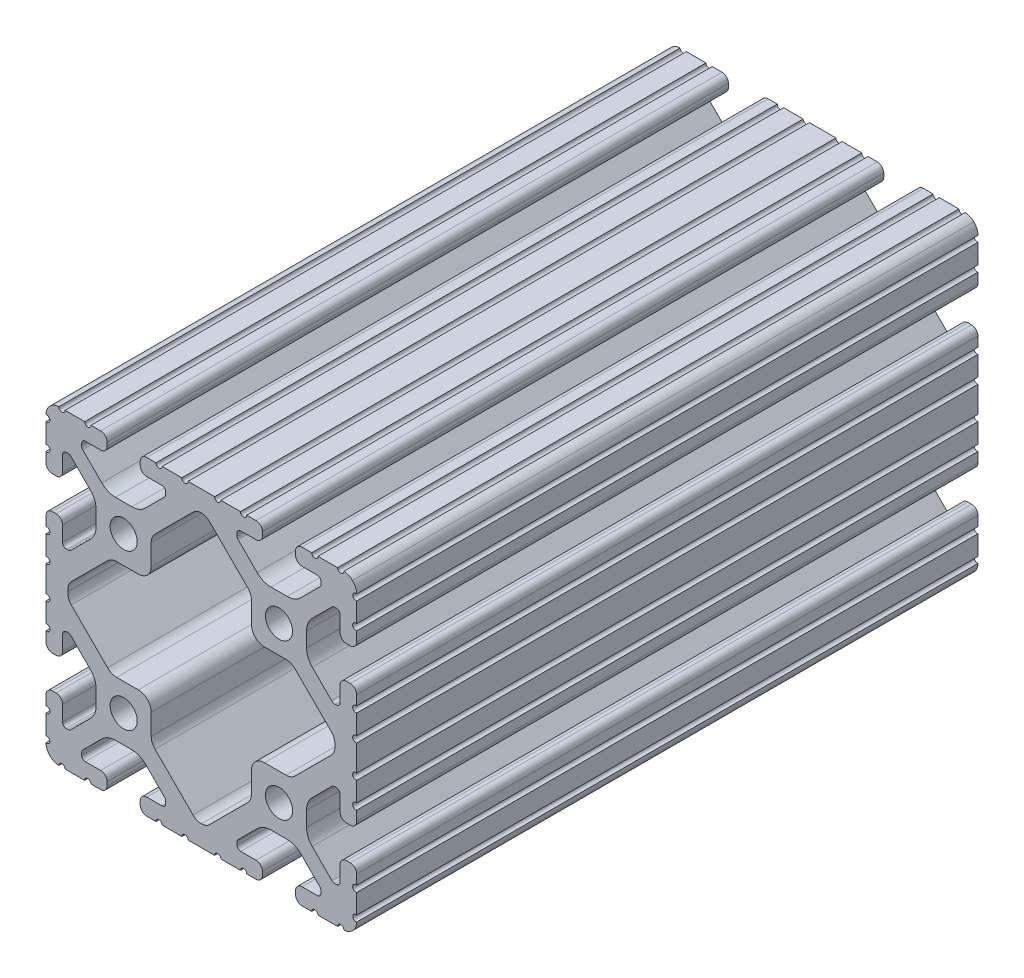
from build123d import *

# Parameters (mm, degrees)
SKETCH1_R           = 3.3274
BOSS_EXTRUDE1_DEPTH = 76.2


with BuildPart() as part:
    # Sketch1 → Boss-Extrude1 (new, symmetric)
    with BuildSketch(Plane.XY):
        with BuildLine():
            Line((-4.777313069, 38.1), (-9.605274992, 38.1))
            ThreePointArc((-9.605274992, 38.1), (-10.367071033, 37.320370693), (-11.128867074, 38.1))
            Line((-11.128867074, 38.1), (-13.4112, 38.1))
            ThreePointArc((-13.4112, 38.1), (-14.524751759, 37.638751759), (-14.986, 36.5252))
            Line((-14.986, 36.5252), (-14.986, 35.6108))
            ThreePointArc((-14.986, 35.6108), (-14.524751759, 34.497248241), (-13.4112, 34.036))
            Line((-13.4112, 34.036), (-9.652, 34.036))
            ThreePointArc((-9.652, 34.036), (-9.023382072, 33.775617928), (-8.763, 33.147))
            Line((-8.763, 33.147), (-8.763, 32.493548179))
            ThreePointArc((-8.763, 32.493548179), (-8.830670886, 32.153343113), (-9.023381298, 31.864931024))
            Line((-9.023381298, 31.864931024), (-13.690712501, 27.197588341))
            ThreePointArc((-13.690712501, 27.197588341), (-15.231659955, 26.167958114), (-17.049332421, 25.8064))
            Line((-17.049332421, 25.8064), (-21.050667579, 25.8064))
            ThreePointArc((-21.050667579, 25.8064), (-22.868340045, 26.167958114), (-24.409287499, 27.197588341))
            Line((-24.409287499, 27.197588341), (-29.100231244, 31.888543625))
            ThreePointArc((-29.100231244, 31.888543625), (-29.326675076, 32.273872751), (-29.337, 32.720693454))
            Line((-29.337, 32.720693454), (-29.337, 33.147))
            ThreePointArc((-29.337, 33.147), (-29.076617928, 33.775617928), (-28.448, 34.036))
            Line((-28.448, 34.036), (-24.6888, 34.036))
            ThreePointArc((-24.6888, 34.036), (-23.575248241, 34.497248241), (-23.114, 35.6108))
            Line((-23.114, 35.6108), (-23.114, 36.5252))
            ThreePointArc((-23.114, 36.5252), (-23.575248241, 37.638751759), (-24.6888, 38.1))
            Line((-24.6888, 38.1), (-27.077211227, 38.1))
            ThreePointArc((-27.077211227, 38.1), (-27.839158581, 37.32021942), (-28.601105935, 38.1))
            Line((-28.601105935, 38.1), (-33.428778994, 38.1))
            ThreePointArc((-33.428778994, 38.1), (-34.190730434, 37.320215335), (-34.952681874, 38.1))
            ThreePointArc((-34.952681874, 38.1), (-36.106286572, 37.843374398), (-37.086123144, 37.182631793))
            ThreePointArc((-37.086123144, 37.182631793), (-37.837757813, 36.120195002), (-38.1, 34.845457521))
            ThreePointArc((-38.1, 34.845457521), (-37.141472621, 34.109236774), (-38.1, 33.373016026))
            Line((-38.1, 33.373016026), (-38.1, 28.545258062))
            ThreePointArc((-38.1, 28.545258062), (-37.117780706, 27.7845421), (-38.1, 27.023826138))
            Line((-38.1, 27.023826138), (-38.1, 24.630195866))
            ThreePointArc((-38.1, 24.630195866), (-37.638751813, 23.516644236), (-36.525200183, 23.055396049))
            Line((-36.525200183, 23.055396049), (-35.6108, 23.055396049))
            ThreePointArc((-35.6108, 23.055396049), (-34.497248241, 23.51664429), (-34.036, 24.630196049))
            Line((-34.036, 24.630196049), (-34.036, 28.448))
            ThreePointArc((-34.036, 28.448), (-33.775617928, 29.076617928), (-33.147, 29.337))
            Line((-33.147, 29.337), (-32.664287242, 29.337))
            ThreePointArc((-32.664287242, 29.337), (-32.324081166, 29.269328695), (-32.03566854, 29.076617155))
            Line((-32.03566854, 29.076617155), (-27.19758008, 24.238516795))
            ThreePointArc((-27.19758008, 24.238516795), (-26.167955879, 22.697572205), (-25.8064, 20.879905136))
            Line((-25.8064, 20.879905136), (-25.8064, 17.220094864))
            ThreePointArc((-25.8064, 17.220094864), (-26.167955879, 15.402427795), (-27.19758008, 13.861483205))
            Line((-27.19758008, 13.861483205), (-31.948944541, 9.110107057))
            ThreePointArc((-31.948944541, 9.110107057), (-32.333417096, 8.853210196), (-32.786933649, 8.763))
            Line((-32.786933649, 8.763), (-33.060275787, 8.763))
            ThreePointArc((-33.060275787, 8.763), (-33.750216995, 9.048783005), (-34.036, 9.738724213))
            Line((-34.036, 9.738724213), (-34.036, 13.469803585))
            ThreePointArc((-34.036, 13.469803585), (-34.497248348, 14.583355603), (-35.610800366, 15.044603951))
            Line((-35.610800366, 15.044603951), (-36.5252, 15.044603951))
            ThreePointArc((-36.5252, 15.044603951), (-37.638751759, 14.58335571), (-38.1, 13.469803951))
            Line((-38.1, 13.469803951), (-38.1, 11.075039289))
            ThreePointArc((-38.1, 11.075039289), (-37.117000248, 10.313517272), (-38.1, 9.551995255))
            Line((-38.1, 9.551995255), (-38.1, 4.723759308))
            ThreePointArc((-38.1, 4.723759308), (-37.117000248, 3.962237292), (-38.1, 3.200715275))
            Line((-38.1, 3.200715275), (-38.1, -3.200715275))
            ThreePointArc((-38.1, -3.200715275), (-37.117000248, -3.962237292), (-38.1, -4.723759308))
            Line((-38.1, -4.723759308), (-38.1, -9.551995255))
            ThreePointArc((-38.1, -9.551995255), (-37.117000248, -10.313517272), (-38.1, -11.075039289))
            Line((-38.1, -11.075039289), (-38.1, -13.469803951))
            ThreePointArc((-38.1, -13.469803951), (-37.638751759, -14.58335571), (-36.5252, -15.044603951))
            Line((-36.5252, -15.044603951), (-35.610800366, -15.044603951))
            ThreePointArc((-35.610800366, -15.044603951), (-34.497248348, -14.583355603), (-34.036, -13.469803585))
            Line((-34.036, -13.469803585), (-34.036, -9.738724213))
            ThreePointArc((-34.036, -9.738724213), (-33.750216995, -9.048783005), (-33.060275787, -8.763))
            Line((-33.060275787, -8.763), (-32.786933649, -8.763))
            ThreePointArc((-32.786933649, -8.763), (-32.333417096, -8.853210196), (-31.948944541, -9.110107057))
            Line((-31.948944541, -9.110107057), (-27.19758008, -13.861483205))
            ThreePointArc((-27.19758008, -13.861483205), (-26.167955879, -15.402427795), (-25.8064, -17.220094864))
            Line((-25.8064, -17.220094864), (-25.8064, -20.879905136))
            ThreePointArc((-25.8064, -20.879905136), (-26.167955879, -22.697572205), (-27.19758008, -24.238516795))
            Line((-27.19758008, -24.238516795), (-32.03566854, -29.076617155))
            ThreePointArc((-32.03566854, -29.076617155), (-32.324081166, -29.269328695), (-32.664287242, -29.337))
            Line((-32.664287242, -29.337), (-33.147, -29.337))
            ThreePointArc((-33.147, -29.337), (-33.775617928, -29.076617928), (-34.036, -28.448))
            Line((-34.036, -28.448), (-34.036, -24.630196049))
            ThreePointArc((-34.036, -24.630196049), (-34.497248241, -23.51664429), (-35.6108, -23.055396049))
            Line((-35.6108, -23.055396049), (-36.525200183, -23.055396049))
            ThreePointArc((-36.525200183, -23.055396049), (-37.638751813, -23.516644236), (-38.1, -24.630195866))
            Line((-38.1, -24.630195866), (-38.1, -27.023826138))
            ThreePointArc((-38.1, -27.023826138), (-37.117780706, -27.7845421), (-38.1, -28.545258062))
            Line((-38.1, -28.545258062), (-38.1, -33.373016026))
            ThreePointArc((-38.1, -33.373016026), (-37.141472621, -34.109236774), (-38.1, -34.845457521))
            ThreePointArc((-38.1, -34.845457521), (-37.837757813, -36.120195002), (-37.086123144, -37.182631793))
            ThreePointArc((-37.086123144, -37.182631793), (-36.106286572, -37.843374398), (-34.952681874, -38.1))
            ThreePointArc((-34.952681874, -38.1), (-34.190730434, -37.320215335), (-33.428778994, -38.1))
            Line((-33.428778994, -38.1), (-28.601105935, -38.1))
            ThreePointArc((-28.601105935, -38.1), (-27.839158581, -37.32021942), (-27.077211227, -38.1))
            Line((-27.077211227, -38.1), (-24.6888, -38.1))
            ThreePointArc((-24.6888, -38.1), (-23.575248241, -37.638751759), (-23.114, -36.5252))
            Line((-23.114, -36.5252), (-23.114, -35.6108))
            ThreePointArc((-23.114, -35.6108), (-23.575248241, -34.497248241), (-24.6888, -34.036))
            Line((-24.6888, -34.036), (-28.448, -34.036))
            ThreePointArc((-28.448, -34.036), (-29.076617928, -33.775617928), (-29.337, -33.147))
            Line((-29.337, -33.147), (-29.337, -32.720693454))
            ThreePointArc((-29.337, -32.720693454), (-29.326675076, -32.273872751), (-29.100231244, -31.888543625))
            Line((-29.100231244, -31.888543625), (-24.409287499, -27.197588341))
            ThreePointArc((-24.409287499, -27.197588341), (-22.868340045, -26.167958114), (-21.050667579, -25.8064))
            Line((-21.050667579, -25.8064), (-17.049332421, -25.8064))
            ThreePointArc((-17.049332421, -25.8064), (-15.231659955, -26.167958114), (-13.690712501, -27.197588341))
            Line((-13.690712501, -27.197588341), (-9.023381298, -31.864931024))
            ThreePointArc((-9.023381298, -31.864931024), (-8.830670886, -32.153343113), (-8.763, -32.493548179))
            Line((-8.763, -32.493548179), (-8.763, -33.147))
            ThreePointArc((-8.763, -33.147), (-9.023382072, -33.775617928), (-9.652, -34.036))
            Line((-9.652, -34.036), (-13.4112, -34.036))
            ThreePointArc((-13.4112, -34.036), (-14.524751759, -34.497248241), (-14.986, -35.6108))
            Line((-14.986, -35.6108), (-14.986, -36.5252))
            ThreePointArc((-14.986, -36.5252), (-14.524751759, -37.638751759), (-13.4112, -38.1))
            Line((-13.4112, -38.1), (-11.128867074, -38.1))
            ThreePointArc((-11.128867074, -38.1), (-10.367071033, -37.320370693), (-9.605274992, -38.1))
            Line((-9.605274992, -38.1), (-4.777313069, -38.1))
            ThreePointArc((-4.777313069, -38.1), (-4.015517029, -37.320370693), (-3.253720988, -38.1))
            Line((-3.253720988, -38.1), (3.253720988, -38.1))
            ThreePointArc((3.253720988, -38.1), (4.015517029, -37.320370693), (4.777313069, -38.1))
            Line((4.777313069, -38.1), (9.605274992, -38.1))
            ThreePointArc((9.605274992, -38.1), (10.367071033, -37.320370693), (11.128867074, -38.1))
            Line((11.128867074, -38.1), (13.4112, -38.1))
            ThreePointArc((13.4112, -38.1), (14.524751759, -37.638751759), (14.986, -36.5252))
            Line((14.986, -36.5252), (14.986, -35.6108))
            ThreePointArc((14.986, -35.6108), (14.524751759, -34.497248241), (13.4112, -34.036))
            Line((13.4112, -34.036), (9.652, -34.036))
            ThreePointArc((9.652, -34.036), (9.023382072, -33.775617928), (8.763, -33.147))
            Line((8.763, -33.147), (8.763, -32.493548179))
            ThreePointArc((8.763, -32.493548179), (8.830670886, -32.153343113), (9.023381298, -31.864931024))
            Line((9.023381298, -31.864931024), (13.690712501, -27.197588341))
            ThreePointArc((13.690712501, -27.197588341), (15.231659955, -26.167958114), (17.049332421, -25.8064))
            Line((17.049332421, -25.8064), (21.050667579, -25.8064))
            ThreePointArc((21.050667579, -25.8064), (22.868340045, -26.167958114), (24.409287499, -27.197588341))
            Line((24.409287499, -27.197588341), (29.100231244, -31.888543625))
            ThreePointArc((29.100231244, -31.888543625), (29.326675076, -32.273872751), (29.337, -32.720693454))
            Line((29.337, -32.720693454), (29.337, -33.147))
            ThreePointArc((29.337, -33.147), (29.076617928, -33.775617928), (28.448, -34.036))
            Line((28.448, -34.036), (24.6888, -34.036))
            ThreePointArc((24.6888, -34.036), (23.575248241, -34.497248241), (23.114, -35.6108))
            Line((23.114, -35.6108), (23.114, -36.5252))
            ThreePointArc((23.114, -36.5252), (23.575248241, -37.638751759), (24.6888, -38.1))
            Line((24.6888, -38.1), (27.077211227, -38.1))
            ThreePointArc((27.077211227, -38.1), (27.839158581, -37.32021942), (28.601105935, -38.1))
            Line((28.601105935, -38.1), (33.428778994, -38.1))
            ThreePointArc((33.428778994, -38.1), (34.190730434, -37.320215335), (34.952681874, -38.1))
            ThreePointArc((34.952681874, -38.1), (36.106286572, -37.843374398), (37.086123144, -37.182631793))
            ThreePointArc((37.086123144, -37.182631793), (37.837757813, -36.120195002), (38.1, -34.845457521))
            ThreePointArc((38.1, -34.845457521), (37.141472621, -34.109236774), (38.1, -33.373016026))
            Line((38.1, -33.373016026), (38.1, -28.545258062))
            ThreePointArc((38.1, -28.545258062), (37.117780706, -27.7845421), (38.1, -27.023826138))
            Line((38.1, -27.023826138), (38.1, -24.630195866))
            ThreePointArc((38.1, -24.630195866), (37.638751813, -23.516644236), (36.525200183, -23.055396049))
            Line((36.525200183, -23.055396049), (35.6108, -23.055396049))
            ThreePointArc((35.6108, -23.055396049), (34.497248241, -23.51664429), (34.036, -24.630196049))
            Line((34.036, -24.630196049), (34.036, -28.448))
            ThreePointArc((34.036, -28.448), (33.775617928, -29.076617928), (33.147, -29.337))
            Line((33.147, -29.337), (32.664287242, -29.337))
            ThreePointArc((32.664287242, -29.337), (32.324081166, -29.269328695), (32.03566854, -29.076617155))
            Line((32.03566854, -29.076617155), (27.19758008, -24.238516795))
            ThreePointArc((27.19758008, -24.238516795), (26.167955879, -22.697572205), (25.8064, -20.879905136))
            Line((25.8064, -20.879905136), (25.8064, -17.220094864))
            ThreePointArc((25.8064, -17.220094864), (26.167955879, -15.402427795), (27.19758008, -13.861483205))
            Line((27.19758008, -13.861483205), (31.948944541, -9.110107057))
            ThreePointArc((31.948944541, -9.110107057), (32.333417096, -8.853210196), (32.786933649, -8.763))
            Line((32.786933649, -8.763), (33.060275787, -8.763))
            ThreePointArc((33.060275787, -8.763), (33.750216995, -9.048783005), (34.036, -9.738724213))
            Line((34.036, -9.738724213), (34.036, -13.469803585))
            ThreePointArc((34.036, -13.469803585), (34.497248348, -14.583355603), (35.610800366, -15.044603951))
            Line((35.610800366, -15.044603951), (36.5252, -15.044603951))
            ThreePointArc((36.5252, -15.044603951), (37.638751759, -14.58335571), (38.1, -13.469803951))
            Line((38.1, -13.469803951), (38.1, -11.075039289))
            ThreePointArc((38.1, -11.075039289), (37.117000248, -10.313517272), (38.1, -9.551995255))
            Line((38.1, -9.551995255), (38.1, -4.723759308))
            ThreePointArc((38.1, -4.723759308), (37.117000248, -3.962237292), (38.1, -3.200715275))
            Line((38.1, -3.200715275), (38.1, 3.200715275))
            ThreePointArc((38.1, 3.200715275), (37.117000248, 3.962237292), (38.1, 4.723759308))
            Line((38.1, 4.723759308), (38.1, 9.551995255))
            ThreePointArc((38.1, 9.551995255), (37.117000248, 10.313517272), (38.1, 11.075039289))
            Line((38.1, 11.075039289), (38.1, 13.469803951))
            ThreePointArc((38.1, 13.469803951), (37.638751759, 14.58335571), (36.5252, 15.044603951))
            Line((36.5252, 15.044603951), (35.610800366, 15.044603951))
            ThreePointArc((35.610800366, 15.044603951), (34.497248348, 14.583355603), (34.036, 13.469803585))
            Line((34.036, 13.469803585), (34.036, 9.738724213))
            ThreePointArc((34.036, 9.738724213), (33.750216995, 9.048783005), (33.060275787, 8.763))
            Line((33.060275787, 8.763), (32.786933649, 8.763))
            ThreePointArc((32.786933649, 8.763), (32.333417096, 8.853210196), (31.948944541, 9.110107057))
            Line((31.948944541, 9.110107057), (27.19758008, 13.861483205))
            ThreePointArc((27.19758008, 13.861483205), (26.167955879, 15.402427795), (25.8064, 17.220094864))
            Line((25.8064, 17.220094864), (25.8064, 20.879905136))
            ThreePointArc((25.8064, 20.879905136), (26.167955879, 22.697572205), (27.19758008, 24.238516795))
            Line((27.19758008, 24.238516795), (32.03566854, 29.076617155))
            ThreePointArc((32.03566854, 29.076617155), (32.324081166, 29.269328695), (32.664287242, 29.337))
            Line((32.664287242, 29.337), (33.147, 29.337))
            ThreePointArc((33.147, 29.337), (33.775617928, 29.076617928), (34.036, 28.448))
            Line((34.036, 28.448), (34.036, 24.630196049))
            ThreePointArc((34.036, 24.630196049), (34.497248241, 23.51664429), (35.6108, 23.055396049))
            Line((35.6108, 23.055396049), (36.525200183, 23.055396049))
            ThreePointArc((36.525200183, 23.055396049), (37.638751813, 23.516644236), (38.1, 24.630195866))
            Line((38.1, 24.630195866), (38.1, 27.023826138))
            ThreePointArc((38.1, 27.023826138), (37.117780706, 27.7845421), (38.1, 28.545258062))
            Line((38.1, 28.545258062), (38.1, 33.373016026))
            ThreePointArc((38.1, 33.373016026), (37.141472621, 34.109236774), (38.1, 34.845457521))
            ThreePointArc((38.1, 34.845457521), (37.837757813, 36.120195002), (37.086123144, 37.182631793))
            ThreePointArc((37.086123144, 37.182631793), (36.106286572, 37.843374398), (34.952681874, 38.1))
            ThreePointArc((34.952681874, 38.1), (34.190730434, 37.320215335), (33.428778994, 38.1))
            Line((33.428778994, 38.1), (28.601105935, 38.1))
            ThreePointArc((28.601105935, 38.1), (27.839158581, 37.32021942), (27.077211227, 38.1))
            Line((27.077211227, 38.1), (24.6888, 38.1))
            ThreePointArc((24.6888, 38.1), (23.575248241, 37.638751759), (23.114, 36.5252))
            Line((23.114, 36.5252), (23.114, 35.6108))
            ThreePointArc((23.114, 35.6108), (23.575248241, 34.497248241), (24.6888, 34.036))
            Line((24.6888, 34.036), (28.448, 34.036))
            ThreePointArc((28.448, 34.036), (29.076617928, 33.775617928), (29.337, 33.147))
            Line((29.337, 33.147), (29.337, 32.720693454))
            ThreePointArc((29.337, 32.720693454), (29.326675076, 32.273872751), (29.100231244, 31.888543625))
            Line((29.100231244, 31.888543625), (24.409287499, 27.197588341))
            ThreePointArc((24.409287499, 27.197588341), (22.868340045, 26.167958114), (21.050667579, 25.8064))
            Line((21.050667579, 25.8064), (17.049332421, 25.8064))
            ThreePointArc((17.049332421, 25.8064), (15.231659955, 26.167958114), (13.690712501, 27.197588341))
            Line((13.690712501, 27.197588341), (9.023381298, 31.864931024))
            ThreePointArc((9.023381298, 31.864931024), (8.830670886, 32.153343113), (8.763, 32.493548179))
            Line((8.763, 32.493548179), (8.763, 33.147))
            ThreePointArc((8.763, 33.147), (9.023382072, 33.775617928), (9.652, 34.036))
            Line((9.652, 34.036), (13.4112, 34.036))
            ThreePointArc((13.4112, 34.036), (14.524751759, 34.497248241), (14.986, 35.6108))
            Line((14.986, 35.6108), (14.986, 36.5252))
            ThreePointArc((14.986, 36.5252), (14.524751759, 37.638751759), (13.4112, 38.1))
            Line((13.4112, 38.1), (11.128867074, 38.1))
            ThreePointArc((11.128867074, 38.1), (10.367071033, 37.320370693), (9.605274992, 38.1))
            Line((9.605274992, 38.1), (4.777313069, 38.1))
            ThreePointArc((4.777313069, 38.1), (4.015517029, 37.320370693), (3.253720988, 38.1))
            Line((3.253720988, 38.1), (-3.253720988, 38.1))
            ThreePointArc((-3.253720988, 38.1), (-4.015517029, 37.320370693), (-4.777313069, 38.1))
        make_face()
        with Locations((-19.05, 19.05)):
            Circle(SKETCH1_R, mode=Mode.SUBTRACT)
        with Locations((-19.05, -19.05)):
            Circle(SKETCH1_R, mode=Mode.SUBTRACT)
        with Locations((19.05, -19.05)):
            Circle(SKETCH1_R, mode=Mode.SUBTRACT)
        with Locations((19.05, 19.05)):
            Circle(SKETCH1_R, mode=Mode.SUBTRACT)
        with BuildLine():
            Line((-11.363666791, -22.843321003), (-2.051515952, -32.155494748))
            ThreePointArc((-2.051515952, -32.155494748), (-1.11031328, -32.786013752), (0, -33.011005091))
            ThreePointArc((0, -33.011005091), (1.11031328, -32.786013752), (2.051515952, -32.155494748))
            Line((2.051515952, -32.155494748), (11.363666791, -22.843321003))
            ThreePointArc((11.363666791, -22.843321003), (12.051918263, -21.813277828), (12.2936, -20.598259734))
            Line((12.2936, -20.598259734), (12.2936, -15.4686))
            ThreePointArc((12.2936, -15.4686), (13.22353597, -13.22353597), (15.4686, -12.2936))
            Line((15.4686, -12.2936), (20.769026744, -12.2936))
            ThreePointArc((20.769026744, -12.2936), (21.984048446, -12.051916769), (23.014093535, -11.363661269))
            Line((23.014093535, -11.363661269), (31.902125566, -2.475607377))
            ThreePointArc((31.902125566, -2.475607377), (32.607298578, -1.335259481), (32.728725173, 0))
            ThreePointArc((32.728725173, 0), (32.607298578, 1.335259481), (31.902125566, 2.475607377))
            Line((31.902125566, 2.475607377), (23.014093535, 11.363661269))
            ThreePointArc((23.014093535, 11.363661269), (21.984048446, 12.051916769), (20.769026744, 12.2936))
            Line((20.769026744, 12.2936), (15.4686, 12.2936))
            ThreePointArc((15.4686, 12.2936), (13.22353597, 13.22353597), (12.2936, 15.4686))
            Line((12.2936, 15.4686), (12.2936, 20.598259734))
            ThreePointArc((12.2936, 20.598259734), (12.051918263, 21.813277828), (11.363666791, 22.843321003))
            Line((11.363666791, 22.843321003), (2.051515952, 32.155494748))
            ThreePointArc((2.051515952, 32.155494748), (1.11031328, 32.786013752), (0, 33.011005091))
            ThreePointArc((0, 33.011005091), (-1.11031328, 32.786013752), (-2.051515952, 32.155494748))
            Line((-2.051515952, 32.155494748), (-11.363666791, 22.843321003))
            ThreePointArc((-11.363666791, 22.843321003), (-12.051918263, 21.813277828), (-12.2936, 20.598259734))
            Line((-12.2936, 20.598259734), (-12.2936, 15.4686))
            ThreePointArc((-12.2936, 15.4686), (-13.22353597, 13.22353597), (-15.4686, 12.2936))
            Line((-15.4686, 12.2936), (-20.769026744, 12.2936))
            ThreePointArc((-20.769026744, 12.2936), (-21.984048446, 12.051916769), (-23.014093535, 11.363661269))
            Line((-23.014093535, 11.363661269), (-31.902125566, 2.475607377))
            ThreePointArc((-31.902125566, 2.475607377), (-32.607298578, 1.335259481), (-32.728725173, 0))
            ThreePointArc((-32.728725173, 0), (-32.607298578, -1.335259481), (-31.902125566, -2.475607377))
            Line((-31.902125566, -2.475607377), (-23.014093535, -11.363661269))
            ThreePointArc((-23.014093535, -11.363661269), (-21.984048446, -12.051916769), (-20.769026744, -12.2936))
            Line((-20.769026744, -12.2936), (-15.4686, -12.2936))
            ThreePointArc((-15.4686, -12.2936), (-13.22353597, -13.22353597), (-12.2936, -15.4686))
            Line((-12.2936, -15.4686), (-12.2936, -20.598259734))
            ThreePointArc((-12.2936, -20.598259734), (-12.051918263, -21.813277828), (-11.363666791, -22.843321003))
        make_face(mode=Mode.SUBTRACT)
    extrude(amount=BOSS_EXTRUDE1_DEPTH, both=True)


solid = part.part
